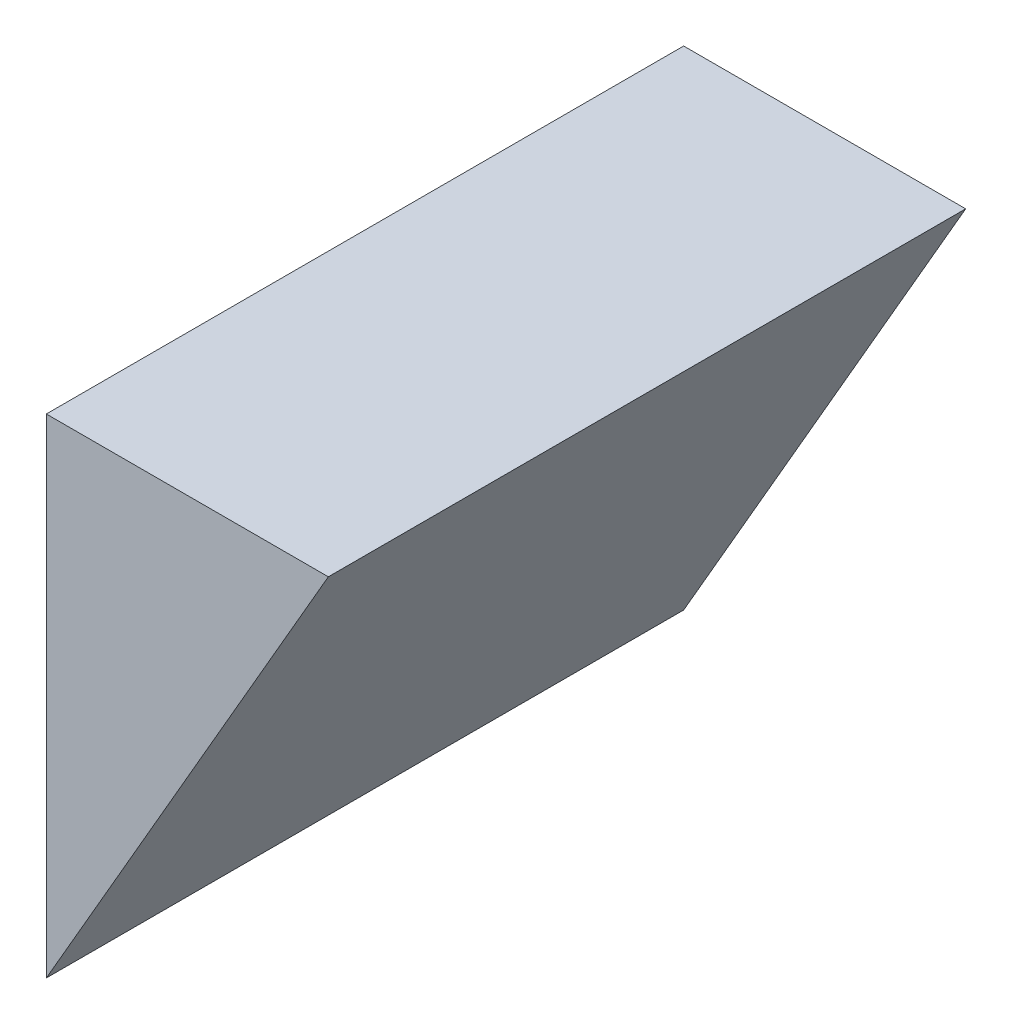
from build123d import *

# Parameters (mm, degrees)
BOSS_EXTRUDE2_DEPTH = 39.3


with BuildPart() as part:
    # Sketch1 → Boss-Extrude2 (new body)
    with BuildSketch(Plane.XY):
        Polygon((0, 0), (0, -30.120363544), (17.39, 0), align=None)
    extrude(amount=BOSS_EXTRUDE2_DEPTH)


solid = part.part
